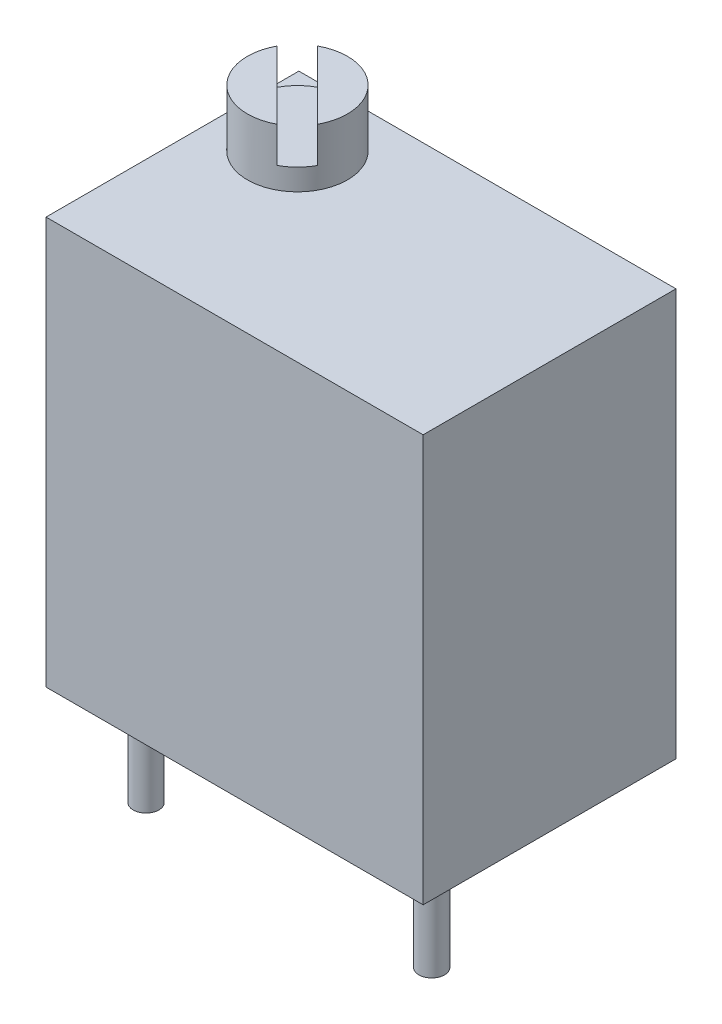
from build123d import *

# Parameters (mm, degrees)
SKETCH1_W      = 6.7056
SKETCH1_H      = 4.4958
EXTRUDE1_DEPTH = 7.239
SKETCH2_R      = 0.889
EXTRUDE2_DEPTH = 1.016
EXTRUDE3_DEPTH = 0.635
SKETCH4_R      = 0.2286
EXTRUDE4_DEPTH = 4.7752
SKETCH5_W      = 5.5372
SKETCH5_H      = 2.8702
PCB_TRIM_DEPTH = 12.121313933


with BuildPart() as part:
    # Sketch1 → Extrude1 (new body)
    with BuildSketch(Plane(origin=(0, 0, 0), x_dir=(1, 0, 0), z_dir=(0, 1, 0))):
        with Locations((2.5908, 1.2319)):
            Rectangle(SKETCH1_W, SKETCH1_H)
    extrude(amount=EXTRUDE1_DEPTH)

    # Sketch2 → Extrude2 (add)
    with BuildSketch(Plane(origin=(0, 7.239, 0), x_dir=(1, 0, 0), z_dir=(0, 1, 0))):
        with Locations(Location((0.4572, 2.2352, 0), (0, 0, 90))):
            Circle(SKETCH2_R)
    extrude(amount=EXTRUDE2_DEPTH)

    # Sketch3 → Extrude3 (cut)
    with BuildSketch(Plane(origin=(0, 8.255, 0), x_dir=(1, 0, 0), z_dir=(0, 1, 0))):
        Polygon((-0.450136371, 2.783326126), (1.005326126, 1.327863629), (1.364536371, 1.687073874), (-0.090926126, 3.142536371), align=None)
    extrude(amount=-EXTRUDE3_DEPTH, mode=Mode.SUBTRACT)

    # Sketch4 → Extrude4 (add)
    with BuildSketch(Plane.XZ):
        with Locations(Location((0, 0, 0), (0, 0, 270))):
            Circle(SKETCH4_R)
        with Locations(Location((5.08, 0, 0), (0, 0, 270))):
            Circle(SKETCH4_R)
        with Locations(Location((2.54, -2.54, 0), (0, 0, 270))):
            Circle(SKETCH4_R)
    extrude(amount=EXTRUDE4_DEPTH)

    # Sketch5 → PCB Trim (cut, through all)
    with BuildSketch(Plane.XY.offset(1.016)):
        with Locations((2.54, -3.3401)):
            Rectangle(SKETCH5_W, SKETCH5_H)
    extrude(amount=-PCB_TRIM_DEPTH, mode=Mode.SUBTRACT)


solid = part.part
